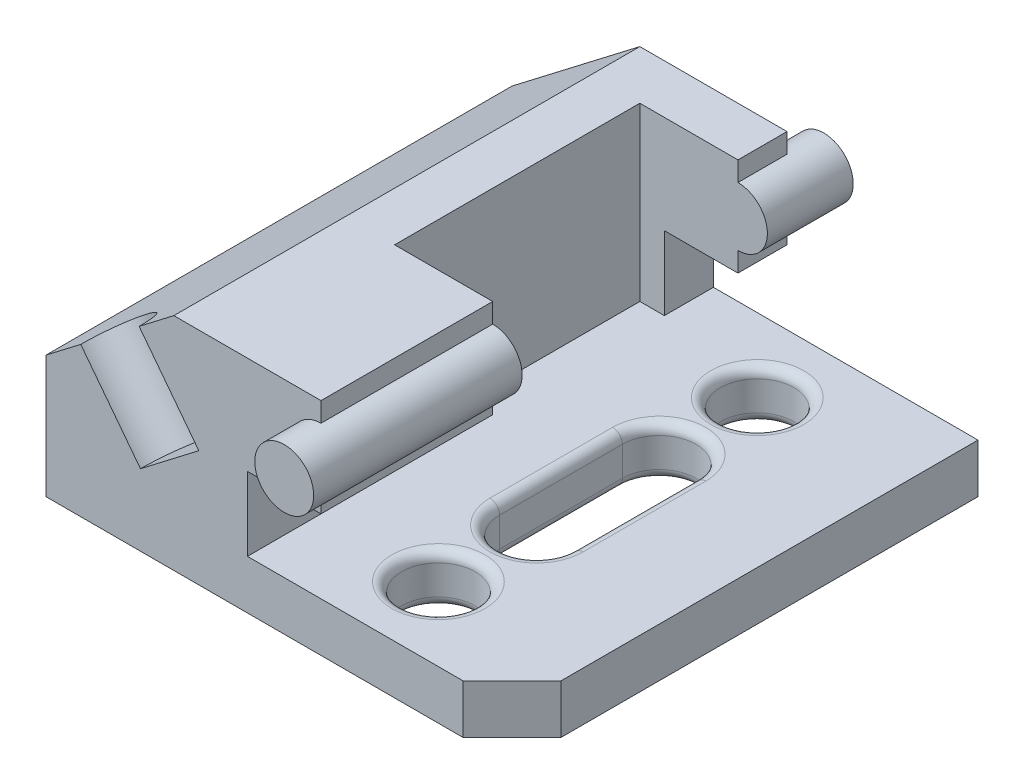
from build123d import *

# Parameters (mm, degrees)
BOSS_EXTRU_1_DEPTH      = 47.5
BOSS_EXTRU_2_DEPTH      = 55
ESQUISSE3_R             = 7.5
ENL_V_MAT_EXTRU_1_DEPTH = 20
ENL_V_MAT_EXTRU_2_REACH = 120.638
ESQUISSE4_W             = 42.689900708
ESQUISSE4_H             = 50
ESQUISSE5_R             = 7.5
ENL_V_MAT_EXTRU_3_DEPTH = 116.217186218
CONG_1_R                = 2
CHANFREIN1_SIZE         = 10


with BuildPart() as part:
    # Esquisse2 → Boss.-Extru.1 (new, symmetric)
    with BuildSketch(Plane.XY):
        with BuildLine():
            Line((0, 25), (0, 0))
            Line((0, 0), (95, 0))
            Line((95, 0), (95, 10))
            Line((95, 10), (41.064507457, 10))
            Line((41.064507457, 10), (41.064507457, 25))
            Line((41.064507457, 25), (56.064507457, 25))
            Line((56.064507457, 25), (56.064507457, 29))
            ThreePointArc((56.064507457, 29), (50.064507457, 35), (56.064507457, 41))
            Line((56.064507457, 41), (56.064507457, 45))
            Line((56.064507457, 45), (26.064507457, 45))
            Line((26.064507457, 45), (0, 25))
        make_face()
    extrude(amount=BOSS_EXTRU_1_DEPTH, both=True)

    # Esquisse2<3> → Boss.-Extru.2 (add, symmetric)
    with BuildSketch(Plane.XY):
        with BuildLine():
            ThreePointArc((62.064507457, 35), (60.307148144, 39.242640687), (56.064507457, 41))
            Line((56.064507457, 41), (56.064507457, 29))
            ThreePointArc((56.064507457, 29), (60.307148144, 30.757359313), (62.064507457, 35))
        make_face()
        with BuildLine():
            Line((56.064507457, 29), (56.064507457, 41))
            ThreePointArc((56.064507457, 41), (50.064507457, 35), (56.064507457, 29))
        make_face()
    extrude(amount=BOSS_EXTRU_2_DEPTH, both=True)

    # Esquisse3 → Enlèv. mat.-Extru.1 (cut)
    with BuildSketch(Plane(origin=(-12.074072829, 15.735238064, 0), x_dir=(0.7933533402912363, 0.6087614290087191, 0), z_dir=(-0.6087614290087192, 0.7933533402912364, 0))):
        with Locations((31.645832042, -47.5)):
            Circle(ESQUISSE3_R)
    extrude(amount=-ENL_V_MAT_EXTRU_1_DEPTH, mode=Mode.SUBTRACT)

    # Enlèv. mat.-Extru.2: up to this face of the body (flat: up to its plane)
    enl_v_mat_extru_2_end = Plane(part.part.faces().sort_by_distance((68.032253728, 10, 0))[0])
    # Esquisse4 → Enlèv. mat.-Extru.2 (cut, up to the picked face)
    with BuildSketch(Plane(origin=(0, 45, 0), x_dir=(1, 0, 0), z_dir=(0, 1, 0)), mode=Mode.PRIVATE) as enl_v_mat_extru_2_sk1:
        with Locations((57.409457811, 12.5)):
            Rectangle(ESQUISSE4_W, ESQUISSE4_H)
    enl_v_mat_extru_2_tool1 = split(extrude(enl_v_mat_extru_2_sk1.sketch, amount=-ENL_V_MAT_EXTRU_2_REACH, mode=Mode.PRIVATE), bisect_by=enl_v_mat_extru_2_end, keep=Keep.BOTH, mode=Mode.PRIVATE)
    add(enl_v_mat_extru_2_tool1.solids().sort_by(Axis((57.409458, 45, -12.5), (0, -1, 0)))[0], mode=Mode.SUBTRACT)

    # Esquisse5 → Enlèv. mat.-Extru.3 (cut, through all)
    with BuildSketch(Plane(origin=(0, 10, 0), x_dir=(1, 0, 0), z_dir=(0, 1, 0))):
        with Locations(Location((65, 32.5, 0), (0, 0, 180))):
            Circle(ESQUISSE5_R)
        with Locations(Location((65, -32.5, 0), (0, 0, 180))):
            Circle(ESQUISSE5_R)
        with BuildLine():
            Line((57.5, -12.5), (57.5, 12.5))
            ThreePointArc((57.5, 12.5), (65, 20), (72.5, 12.5))
            Line((72.5, 12.5), (72.5, -12.5))
            ThreePointArc((72.5, -12.5), (65, -20), (57.5, -12.5))
        make_face()
    extrude(amount=-ENL_V_MAT_EXTRU_3_DEPTH, mode=Mode.SUBTRACT)

    # Congé1
    cong_1_edges = [part.edges().sort_by_distance(p)[0] for p in [
        (72.5, 0, -32.5),
        (72.5, 10, -32.5),
        (65, 0, 20),
        (57.5, 0, 0),
        (65, 0, -20),
        (72.5, 0, 0),
        (65, 10, 20),
        (72.5, 10, 0),
        (65, 10, -20),
        (57.5, 10, 0),
        (72.5, 0, 32.5),
        (72.5, 10, 32.5),
    ]]
    fillet(cong_1_edges, radius=CONG_1_R)

    # Chanfrein1
    chanfrein1_edges = [part.edges().sort_by_distance(p)[0] for p in [
        (95, 5, 47.5),
    ]]
    chamfer(chanfrein1_edges, length=CHANFREIN1_SIZE)


solid = part.part
